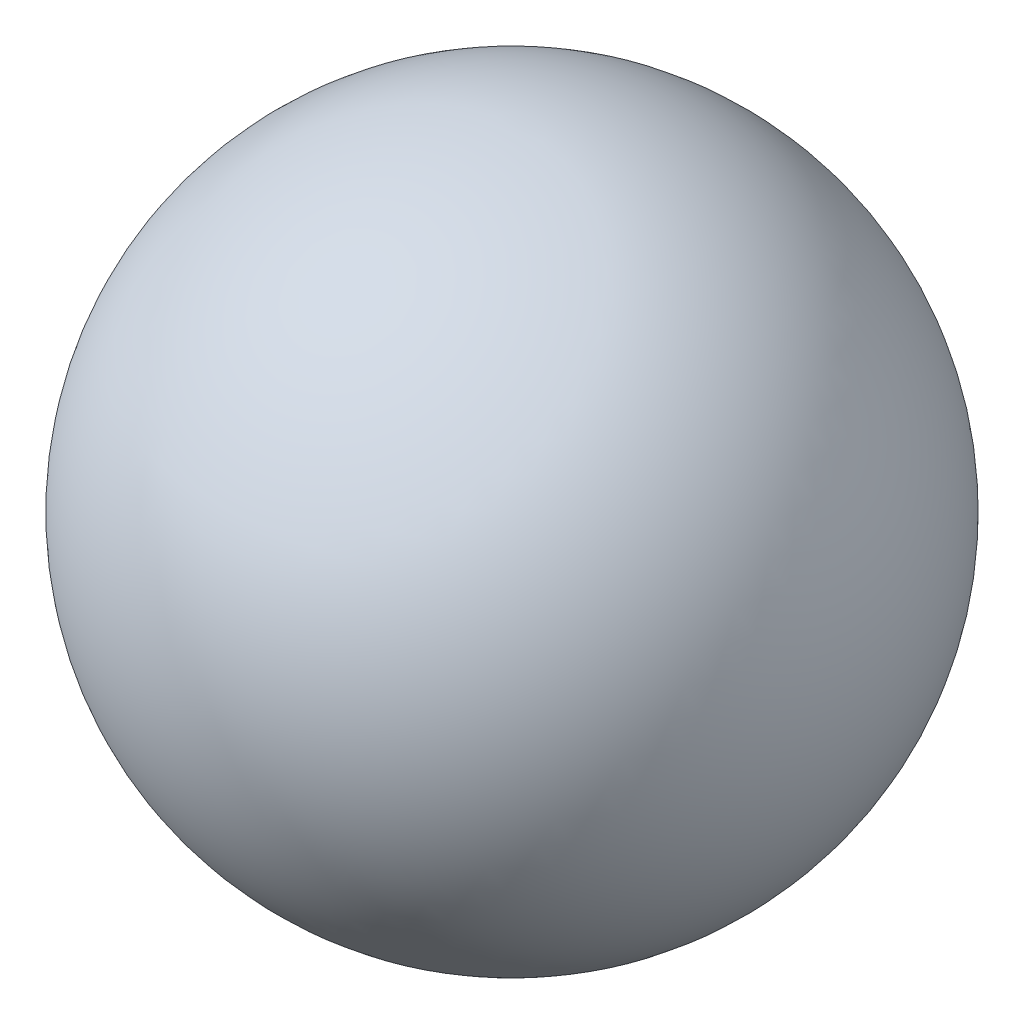
from build123d import *


with BuildPart() as part:
    # Sketch1 → Revolve1 (revolve)
    with BuildSketch(Plane.XY):
        with BuildLine():
            Line((0, 0), (0, 600))
            ThreePointArc((0, 600), (300, 300), (0, 0))
        make_face()
    revolve(axis=Axis((0, 0, 0), (0, 1, 0)))


solid = part.part
